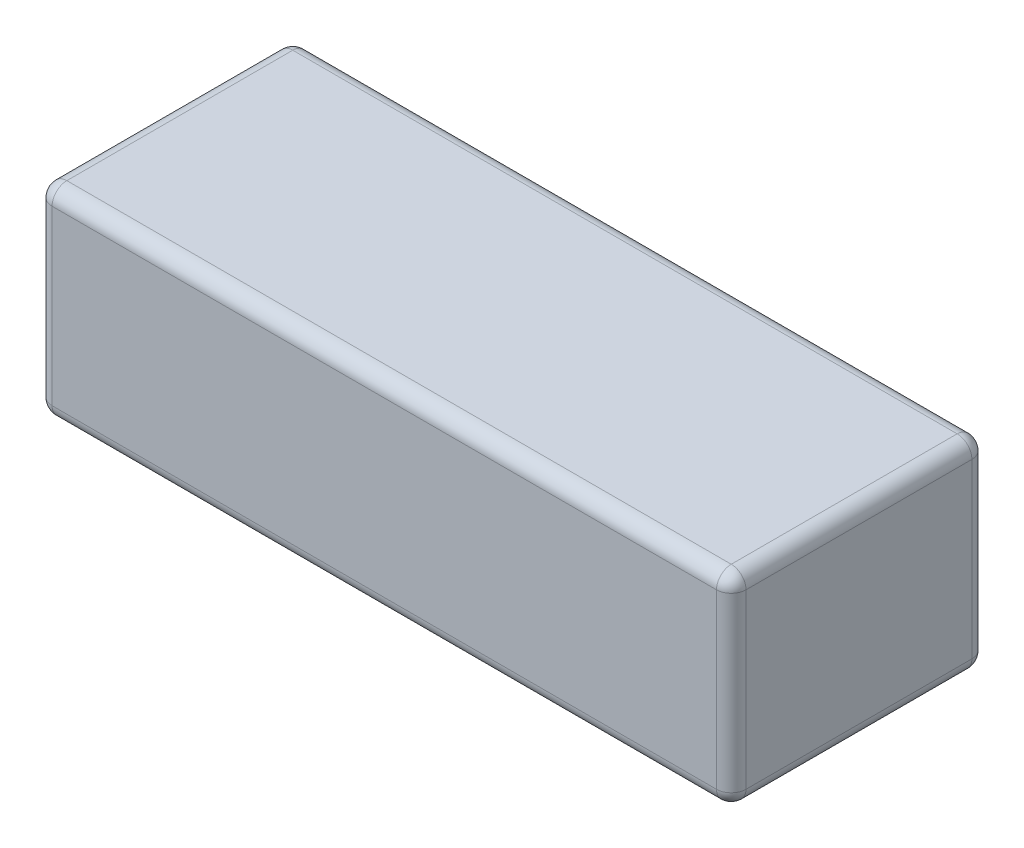
from build123d import *

# Parameters (mm, degrees)
SKETCH1_W           = 47
SKETCH1_H           = 17.3
BOSS_EXTRUDE1_DEPTH = 13.7
FILLET1_R           = 1


with BuildPart() as part:
    # Sketch1 → Boss-Extrude1 (new body)
    with BuildSketch(Plane(origin=(0, 0, 0), x_dir=(1, 0, 0), z_dir=(0, 1, 0))):
        Rectangle(SKETCH1_W, SKETCH1_H)
    extrude(amount=BOSS_EXTRUDE1_DEPTH)

    # Fillet1
    fillet1_edges = [part.edges().sort_by_distance(p)[0] for p in [
        (-23.5, 13.7, 0),
        (0, 13.7, 8.65),
        (23.5, 13.7, 0),
        (0, 0, 8.65),
        (-23.5, 0, 0),
        (0, 0, -8.65),
        (23.5, 0, 0),
        (0, 13.7, -8.65),
        (23.5, 6.85, 8.65),
        (-23.5, 6.85, 8.65),
        (-23.5, 6.85, -8.65),
        (23.5, 6.85, -8.65),
    ]]
    fillet(fillet1_edges, radius=FILLET1_R)


solid = part.part
